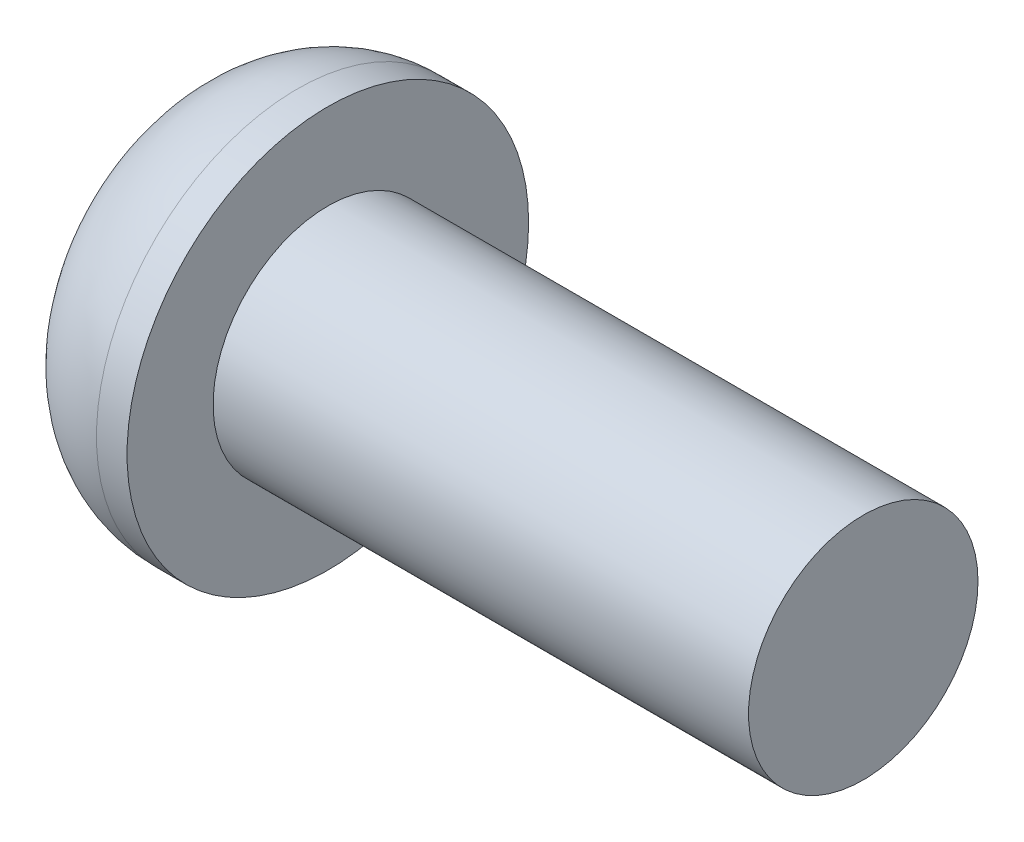
from build123d import *

# Parameters (mm, degrees)
CUT_EXTRUDE1_DEPTH = 4.2


with BuildPart() as part:
    # Sketch1 → Revolve1 (revolve)
    with BuildSketch(Plane.XY, mode=Mode.PRIVATE) as revolve1_sk:
        with BuildLine():
            Line((0, 0), (0, 2.05))
            ThreePointArc((0, 2.05), (0.9372583, 4.3127417), (3.2, 5.25))
            Line((3.2, 5.25), (4, 5.25))
            Line((4, 5.25), (4, 3))
            Line((4, 3), (18, 3))
            Line((18, 3), (18, 0))
            Line((18, 0), (0, 0))
        make_face()
    revolve(revolve1_sk.sketch.rotate(Axis((0, 0, 0), (-1, 0, 0)), 90), axis=Axis((0, 0, 0), (-1, 0, 0)))

    # Sketch2 → Cut-Extrude1 (cut)
    with BuildSketch(Plane.ZY):
        Polygon((2.309401077, 0), (1.154700538, 2), (-1.154700538, 2), (-2.309401077, 0), (-1.154700538, -2), (1.154700538, -2), align=None)
    extrude(amount=-CUT_EXTRUDE1_DEPTH, mode=Mode.SUBTRACT)


solid = part.part
